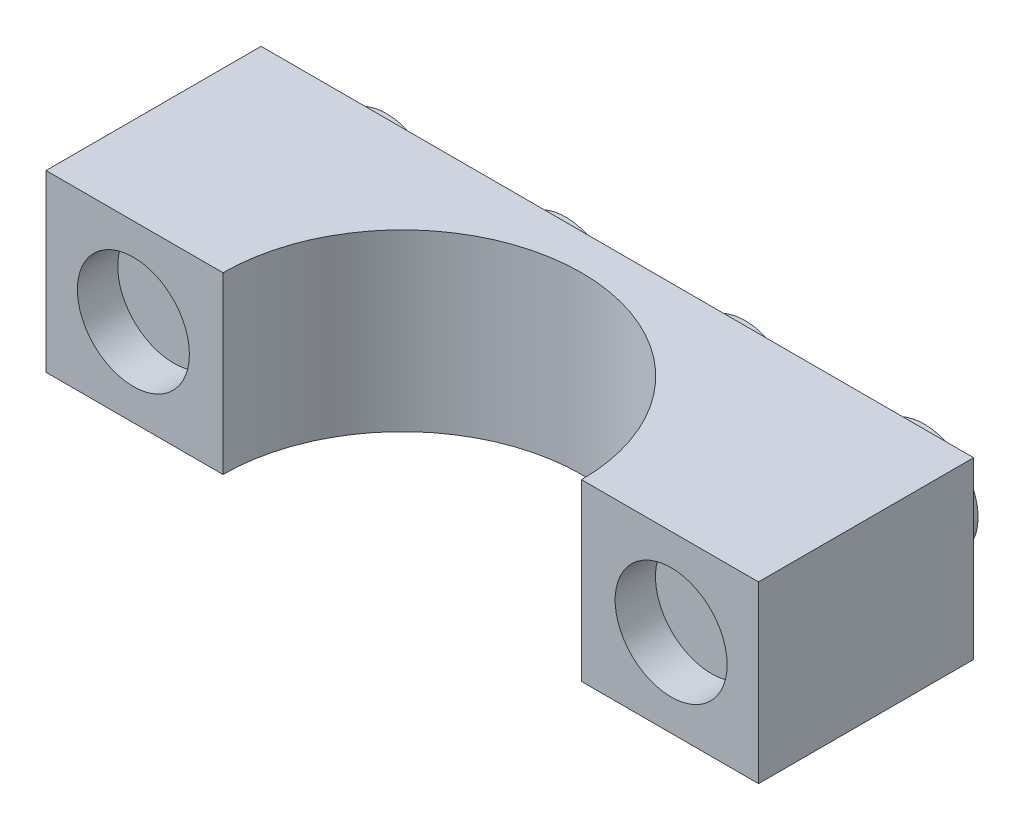
from build123d import *

# Parameters (mm, degrees)
SKETCH_1_W          = 31.8
SKETCH_1_H          = 7.8
EXTRUDE_2_DEPTH     = 9.6
SKETCH_2_R          = 2.4
EXTRUDE_3_DEPTH     = 1.7
CUT_EXTRUDE_2_DEPTH = 21.144726357
SKETCH_4_R          = 2.5
CUT_EXTRUDE_3_DEPTH = 1.8


with BuildPart() as part:
    # Эскиз1 → Бобышка-Вытянуть2 (new body)
    with BuildSketch(Plane.XY):
        Rectangle(SKETCH_1_W, SKETCH_1_H)
    extrude(amount=EXTRUDE_2_DEPTH)

    # Эскиз2 → Бобышка-Вытянуть3 (add)
    with BuildSketch(Plane(origin=(0, 0, 0), x_dir=(-1, 0, 0), z_dir=(0, 0, -1))):
        with Locations((-12, 0)):
            Circle(SKETCH_2_R)
        with Locations((-4, 0)):
            Circle(SKETCH_2_R)
        with Locations((4, 0)):
            Circle(SKETCH_2_R)
        with Locations((12, 0)):
            Circle(SKETCH_2_R)
    extrude(amount=EXTRUDE_3_DEPTH)

    # Эскиз3 → Вырез-Вытянуть2 (cut, through all)
    with BuildSketch(Plane.XZ.offset(3.9)):
        with BuildLine():
            Line((8, 9.6), (-8, 9.6))
            ThreePointArc((-8, 9.6), (0, 1.6), (8, 9.6))
        make_face()
    extrude(amount=-CUT_EXTRUDE_2_DEPTH, mode=Mode.SUBTRACT)

    # Эскиз4 → Вырез-Вытянуть3 (cut)
    with BuildSketch(Plane.XY.offset(9.6)):
        with Locations((12, 0)):
            Circle(SKETCH_4_R)
        with Locations((-12, 0)):
            Circle(SKETCH_4_R)
    extrude(amount=-CUT_EXTRUDE_3_DEPTH, mode=Mode.SUBTRACT)


solid = part.part
